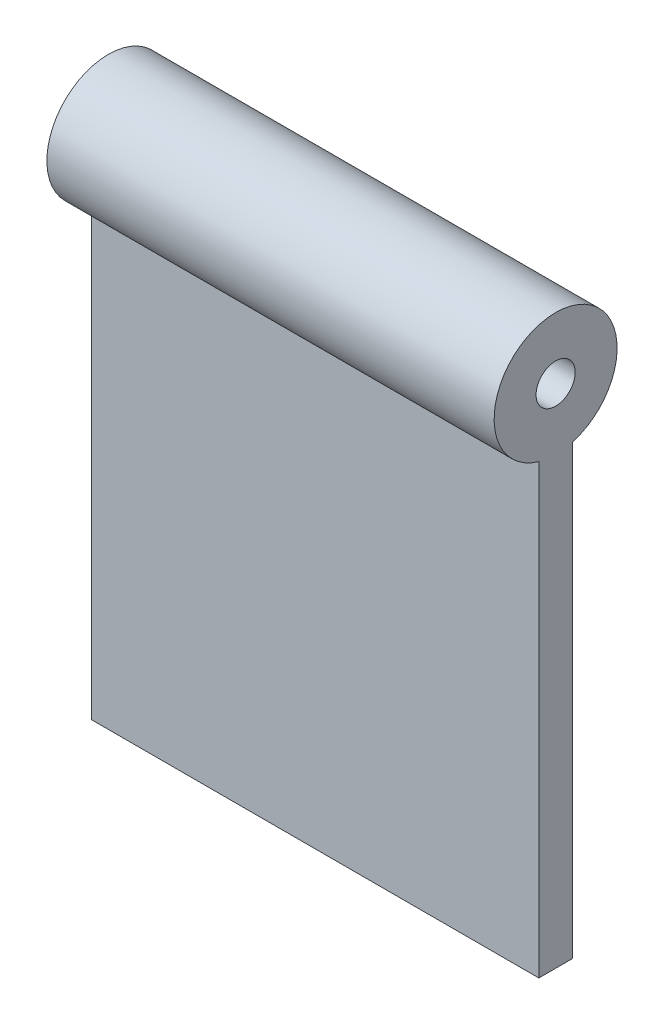
from build123d import *

# Parameters (mm, degrees)
SKETCH_1_R      = 0.35
EXTRUDE_1_DEPTH = 8


with BuildPart() as part:
    # 草图1 → 凸台-拉伸1 (new body)
    with BuildSketch(Plane(origin=(0, 0, 0), x_dir=(0, 0, -1), z_dir=(1, 0, 0))):
        with BuildLine():
            Line((0.3, -1.058300524), (0.3, -9.058300524))
            Line((0.3, -9.058300524), (-0.3, -9.058300524))
            Line((-0.3, -9.058300524), (-0.3, -1.058300524))
            ThreePointArc((-0.3, -1.058300524), (0, 1.1), (0.3, -1.058300524))
        make_face()
        Circle(SKETCH_1_R, mode=Mode.SUBTRACT)
    extrude(amount=EXTRUDE_1_DEPTH)


solid = part.part
